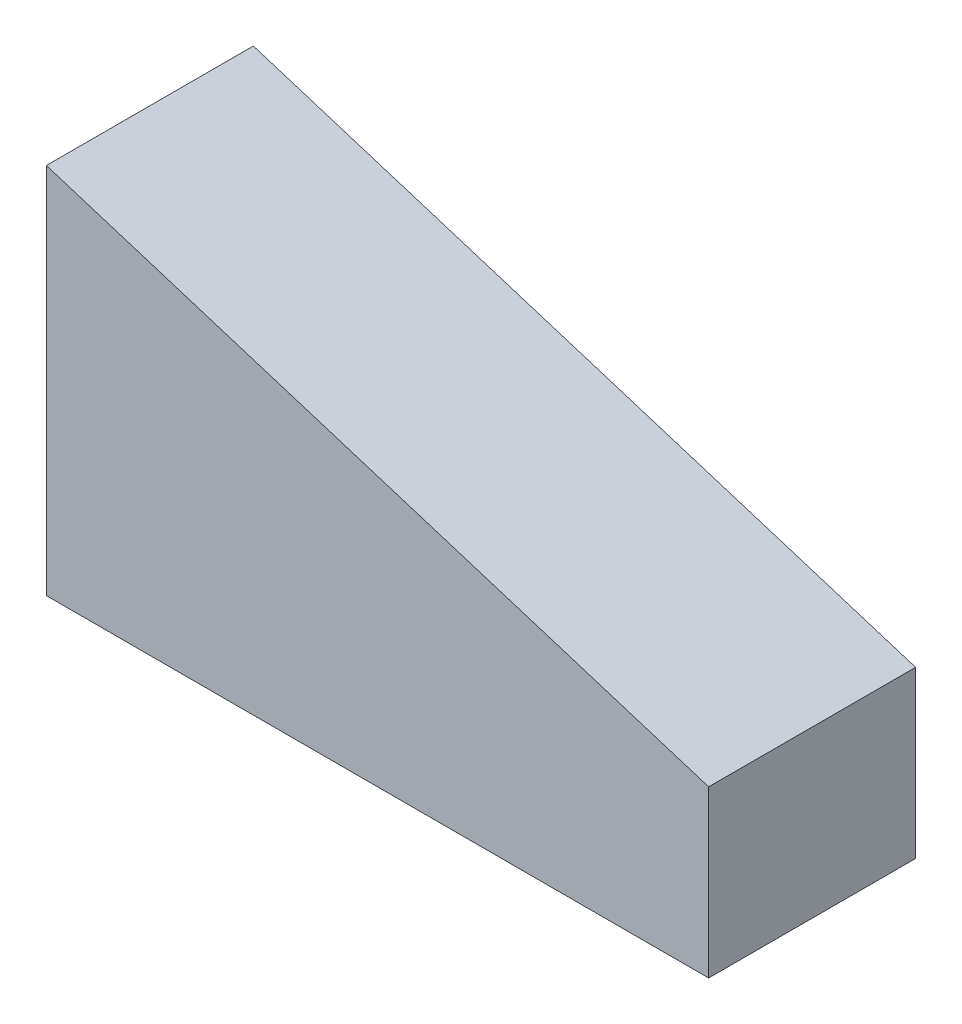
from build123d import *

# Parameters (mm, degrees)
BOSS_EXTRUDE1_DEPTH = 25


with BuildPart() as part:
    # Sketch1 → Boss-Extrude1 (new body)
    with BuildSketch(Plane.XY):
        Polygon((0, 0), (0, 45), (80, 20), (80, 0), align=None)
    extrude(amount=BOSS_EXTRUDE1_DEPTH)


solid = part.part
